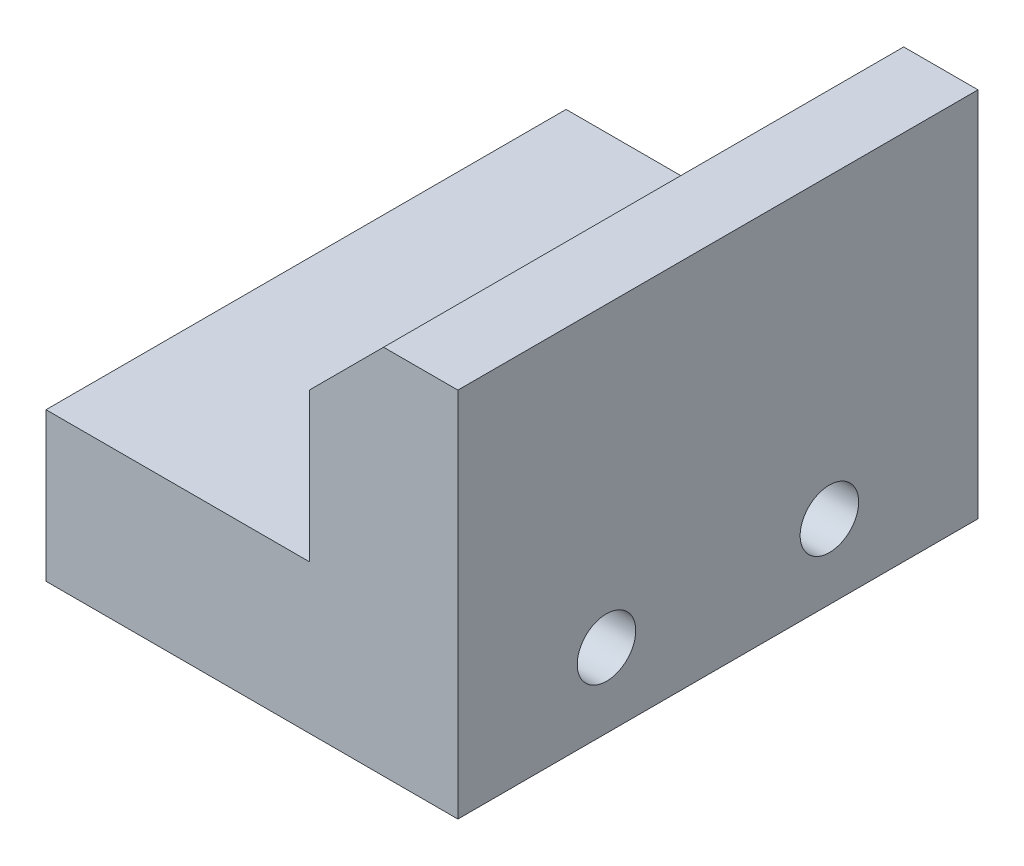
from build123d import *

# Parameters (mm, degrees)
BOSS_EXTRUDE1_DEPTH = 44.45
SKETCH2_R           = 2.8
CUT_EXTRUDE1_DEPTH  = 98.532571483
SKETCH3_R           = 5
CUT_EXTRUDE2_DEPTH  = 60.4


with BuildPart() as part:
    # Sketch1 → Boss-Extrude1 (new, symmetric)
    with BuildSketch(Plane.XY):
        Polygon((70.4, 50.8), (57.7, 50.8), (45, 38.1), (45, 12.7), (0, 12.7), (0, -12.7), (70.4, -12.7), align=None)
    extrude(amount=BOSS_EXTRUDE1_DEPTH, both=True)

    # Sketch2 → Cut-Extrude1 (cut, through all)
    with BuildSketch(Plane(origin=(70.4, 0, 0), x_dir=(0, 0, -1), z_dir=(1, 0, 0))):
        with Locations((-19.05, 0)):
            Circle(SKETCH2_R)
        with Locations((19.05, 0)):
            Circle(SKETCH2_R)
    extrude(amount=-CUT_EXTRUDE1_DEPTH, mode=Mode.SUBTRACT)

    # Sketch3 → Cut-Extrude2 (cut)
    with BuildSketch(Plane(origin=(70.4, 0, 0), x_dir=(0, 0, -1), z_dir=(1, 0, 0))):
        with Locations((-19.05, 0)):
            Circle(SKETCH3_R)
        with Locations((19.05, 0)):
            Circle(SKETCH3_R)
    extrude(amount=-CUT_EXTRUDE2_DEPTH, mode=Mode.SUBTRACT)


solid = part.part
